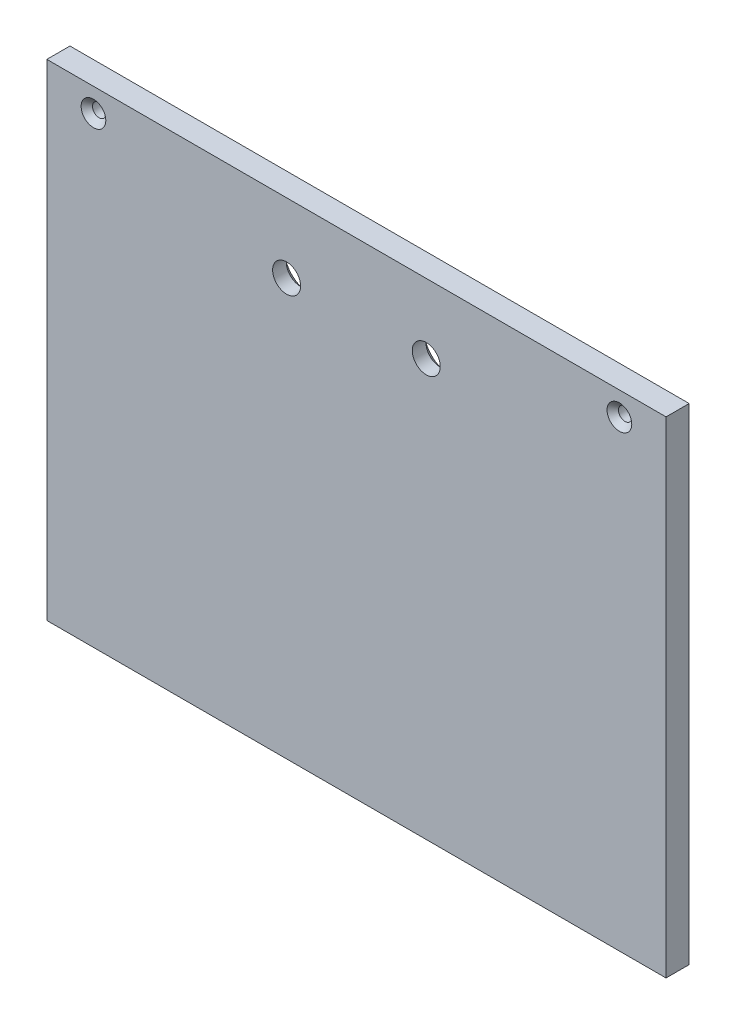
from build123d import *

# Parameters (mm, degrees)
SKETCH1_W                                           = 158
SKETCH1_H                                           = 124
BOSS_EXTRUDE1_DEPTH                                 = 5.9
CSK_FOR_M3_FLAT_HEAD_MACHINE_SCREW1_D               = 3.4
CSK_FOR_M3_FLAT_HEAD_MACHINE_SCREW1_DEPTH           = 10
CSK_FOR_M3_FLAT_HEAD_MACHINE_SCREW1_CSINK_D         = 6.3
CSK_FOR_M3_FLAT_HEAD_MACHINE_SCREW1_CSINK_ANGLE     = 90
CSK_FOR_M3_FLAT_HEAD_MACHINE_SCREW1_TIP             = 1.021463052
CSK_FOR_1_4_FLAT_HEAD_MACHINE_SCREW_100_D           = 7.14248
CSK_FOR_1_4_FLAT_HEAD_MACHINE_SCREW_100_CSINK_D     = 12.8778
CSK_FOR_1_4_FLAT_HEAD_MACHINE_SCREW_100_CSINK_ANGLE = 100


with BuildPart() as part:
    # Sketch1 → Boss-Extrude1 (new body)
    with BuildSketch(Plane.XY):
        Rectangle(SKETCH1_W, SKETCH1_H)
    extrude(amount=BOSS_EXTRUDE1_DEPTH)

    # CSK for M3 Flat Head Machine Screw1
    with Locations(Plane.XY.offset(5.9)):
        with Locations((-67.1, 56), (67.1, 56)):
            CounterSinkHole(CSK_FOR_M3_FLAT_HEAD_MACHINE_SCREW1_D / 2, CSK_FOR_M3_FLAT_HEAD_MACHINE_SCREW1_CSINK_D / 2, depth=CSK_FOR_M3_FLAT_HEAD_MACHINE_SCREW1_DEPTH, counter_sink_angle=CSK_FOR_M3_FLAT_HEAD_MACHINE_SCREW1_CSINK_ANGLE)
            with Locations((0, 0, -(CSK_FOR_M3_FLAT_HEAD_MACHINE_SCREW1_DEPTH + CSK_FOR_M3_FLAT_HEAD_MACHINE_SCREW1_TIP / 2))):  # 118° drill point
                Cone(0, CSK_FOR_M3_FLAT_HEAD_MACHINE_SCREW1_D / 2, CSK_FOR_M3_FLAT_HEAD_MACHINE_SCREW1_TIP, mode=Mode.SUBTRACT)

    # CSK for 1/4 Flat Head Machine Screw (100)1 (through all)
    with Locations(Plane(origin=(0, 0, 0), x_dir=(1, 0, 0), z_dir=(0, 0, -1))):
        with Locations((-17.81875, -44.268219257), (17.81875, -44.268219257)):
            CounterSinkHole(CSK_FOR_1_4_FLAT_HEAD_MACHINE_SCREW_100_D / 2, CSK_FOR_1_4_FLAT_HEAD_MACHINE_SCREW_100_CSINK_D / 2, counter_sink_angle=CSK_FOR_1_4_FLAT_HEAD_MACHINE_SCREW_100_CSINK_ANGLE)


solid = part.part
